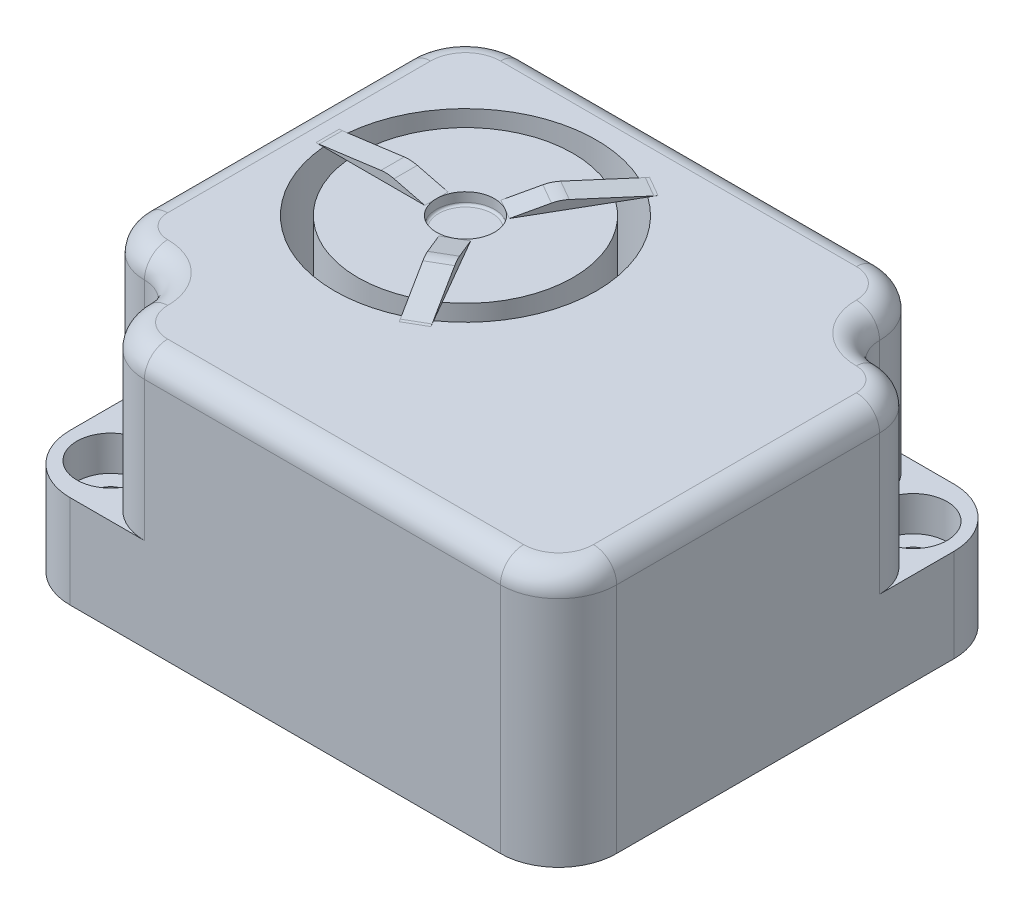
from build123d import *

# Parameters (mm, degrees)
ESQUISSE1_W                                        = 47
ESQUISSE1_H                                        = 39
BOSS_EXTRU_1_DEPTH                                 = 22
CHAMBRAGE_POUR_VIS_T_TE_RONDE_BOMB_E_M_D           = 3
CHAMBRAGE_POUR_VIS_T_TE_RONDE_BOMB_E_M_CBORE_D     = 5.8
CHAMBRAGE_POUR_VIS_T_TE_RONDE_BOMB_E_M_CBORE_DEPTH = 17
ENL_V_MAT_EXTRU_1_DEPTH                            = 14
CONG_1_R                                           = 5
CONG_2_R                                           = 2
ESQUISSE6_R                                        = 11.25
ESQUISSE6_R_2                                      = 9.25
ENL_V_MAT_EXTRU_2_DEPTH                            = 15
ESQUISSE8_R                                        = 2.5
ENL_V_MAT_EXTRU_3_DEPTH                            = 1
BOSS_EXTRU_5_DEPTH                                 = 1
R_P_TITION_CIRCULAIRE1_COUNT                       = 3
CONG_3_R                                           = 2
CONG_4_R                                           = 0.2


with BuildPart() as part:
    # Esquisse1 → Boss.-Extru.1 (new body)
    with BuildSketch(Plane(origin=(0, 0, 0), x_dir=(1, 0, 0), z_dir=(0, 1, 0))):
        Rectangle(ESQUISSE1_W, ESQUISSE1_H)
    extrude(amount=BOSS_EXTRU_1_DEPTH)

    # Chambrage pour vis à tête ronde bombée M31 (through all)
    with Locations(Plane(origin=(0, 22, 0), x_dir=(1, 0, 0), z_dir=(0, 1, 0))):
        with Locations((-19.5, -15), (19.5, 15)):
            CounterBoreHole(CHAMBRAGE_POUR_VIS_T_TE_RONDE_BOMB_E_M_D / 2, CHAMBRAGE_POUR_VIS_T_TE_RONDE_BOMB_E_M_CBORE_D / 2, CHAMBRAGE_POUR_VIS_T_TE_RONDE_BOMB_E_M_CBORE_DEPTH)

    # Esquisse5 → Enlèv. mat.-Extru.1 (cut)
    with BuildSketch(Plane(origin=(0, 22, 0), x_dir=(1, 0, 0), z_dir=(0, 1, 0))):
        with BuildLine():
            Line((-23.5, -8.1), (-23.5, -19.5))
            Line((-23.5, -19.5), (-12.1, -19.5))
            ThreePointArc((-12.1, -19.5), (-15.281980515, -18.181980515), (-16.6, -15))
            ThreePointArc((-16.6, -15), (-17.449390335, -12.949390335), (-19.5, -12.1))
            ThreePointArc((-19.5, -12.1), (-22.328427125, -10.928427125), (-23.5, -8.1))
        make_face()
        with BuildLine():
            Line((23.5, 8.1), (23.5, 19.5))
            Line((23.5, 19.5), (12.1, 19.5))
            ThreePointArc((12.1, 19.5), (15.281980515, 18.181980515), (16.6, 15))
            ThreePointArc((16.6, 15), (17.449390335, 12.949390335), (19.5, 12.1))
            ThreePointArc((19.5, 12.1), (22.328427125, 10.928427125), (23.5, 8.1))
        make_face()
    extrude(amount=-ENL_V_MAT_EXTRU_1_DEPTH, mode=Mode.SUBTRACT)

    # Congé1
    cong_1_edges = [part.edges().sort_by_distance(p)[0] for p in [
        (-23.5, 4, 19.5),
        (23.5, 4, -19.5),
        (23.5, 11, 19.5),
        (-23.5, 11, -19.5),
    ]]
    fillet(cong_1_edges, radius=CONG_1_R)

    # Congé2
    cong_2_edges = [part.edges().sort_by_distance(p)[0] for p in [
        (-17.449390335, 22, 12.949390335),
        (3.2, 22, 19.5),
        (-15.281980515, 22, 18.181980515),
        (-22.328427125, 22, 10.928427125),
        (17.449390335, 22, -12.949390335),
        (-3.2, 22, -19.5),
        (15.281980515, 22, -18.181980515),
        (22.328427125, 22, -10.928427125),
        (23.5, 22, 3.2),
        (-23.5, 22, -3.2),
        (-22.035533906, 22, -18.035533906),
        (22.035533906, 22, 18.035533906),
    ]]
    fillet(cong_2_edges, radius=CONG_2_R)

    # Esquisse6 → Enlèv. mat.-Extru.2 (cut)
    with BuildSketch(Plane(origin=(0, 22, 0), x_dir=(1, 0, 0), z_dir=(0, 1, 0))):
        with Locations(Location((-8.5, 4.5, 0), (0, 0, 270))):
            Circle(ESQUISSE6_R)
        with Locations(Location((-8.5, 4.5, 0), (0, 0, 270))):
            Circle(ESQUISSE6_R_2, mode=Mode.SUBTRACT)
    extrude(amount=-ENL_V_MAT_EXTRU_2_DEPTH, mode=Mode.SUBTRACT)

    # Esquisse8 → Enlèv. mat.-Extru.3 (cut)
    with BuildSketch(Plane(origin=(0, 22, 0), x_dir=(1, 0, 0), z_dir=(0, 1, 0))):
        with Locations(Location((-8.5, 4.5, 0), (0, 0, 270))):
            Circle(ESQUISSE8_R)
    extrude(amount=-ENL_V_MAT_EXTRU_3_DEPTH, mode=Mode.SUBTRACT)

    # Esquisse7 → Boss.-Extru.5 (add, symmetric)
    with BuildSketch(Plane.XY.offset(-4.5)):
        with BuildLine():
            Line((-20.21694009, 22), (-11, 22))
            Line((-11, 22), (-13.641435578, 22.66096111))
            ThreePointArc((-13.641435578, 22.66096111), (-14.200146525, 22.745896439), (-14.764873034, 22.724544554))
            Line((-14.764873034, 22.724544554), (-20.21694009, 22))
        make_face()
    boss_extru_5 = extrude(amount=BOSS_EXTRU_5_DEPTH, both=True)

    # Répétition circulaire1: Boss.-Extru.5 ×3 about axis
    r_p_tition_circulaire1_axis = Axis((-8.5, 0, -4.5), (0, 1, 0))
    for i in range(1, R_P_TITION_CIRCULAIRE1_COUNT):
        add(boss_extru_5.rotate(r_p_tition_circulaire1_axis, i * 360 / R_P_TITION_CIRCULAIRE1_COUNT))

    # Congé3
    cong_3_edges = [part.edges().sort_by_distance(p)[0] for p in [
        (-20.21694009, 22, -4.5),
        (-2.641529955, 22, 5.647167773),
        (-2.641529955, 22, -14.647167773),
    ]]
    fillet(cong_3_edges, radius=CONG_3_R)

    # Congé4
    cong_4_edges = [part.edges().sort_by_distance(p)[0] for p in [
        (-8.5, 21, -7),
    ]]
    fillet(cong_4_edges, radius=CONG_4_R)


solid = part.part
